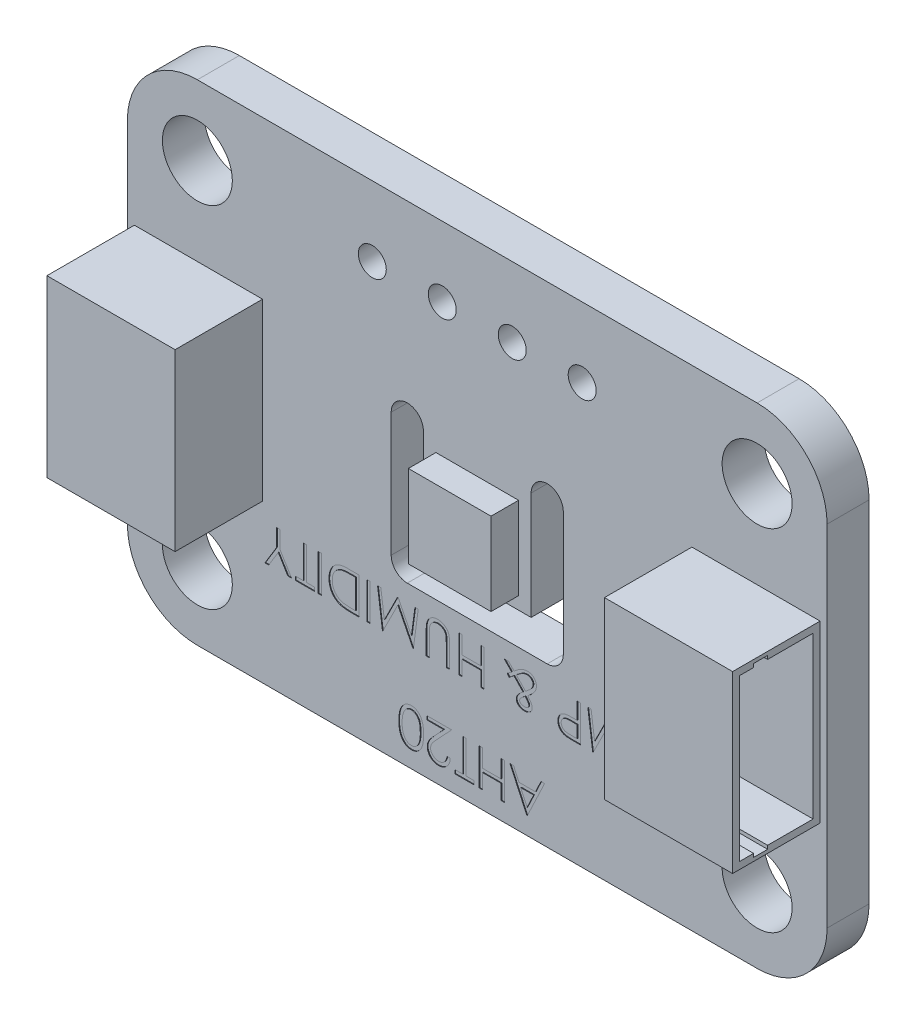
from build123d import *

# Parameters (mm, degrees)
SKETCH1_W           = 25.4
SKETCH1_H           = 17.78
BOSS_EXTRUDE1_DEPTH = 0.762
SKETCH2_R           = 1.27
SKETCH2_R_2         = 0.508
CUT_EXTRUDE1_DEPTH  = 16.577056076
SKETCH6_W           = 4.652
SKETCH6_H           = 6.35
BOSS_EXTRUDE4_DEPTH = 3.175
CUT_EXTRUDE2_DEPTH  = 3.175
CUT_EXTRUDE3_DEPTH  = 16.824118459
FILLET1_R           = 2.54
SKETCH9_W           = 3
SKETCH9_H           = 3
BOSS_EXTRUDE5_DEPTH = 1
SKETCH10_W          = 0.118723291
SKETCH10_H          = 1.322916667
SKETCH10_W_2        = 0.11872329
CUT_EXTRUDE4_DEPTH  = 0.0254


with BuildPart() as part:
    # Sketch1 → Boss-Extrude1 (new, symmetric)
    with BuildSketch(Plane.XY):
        Rectangle(SKETCH1_W, SKETCH1_H)
    extrude(amount=BOSS_EXTRUDE1_DEPTH, both=True)

    # Sketch2 → Cut-Extrude1 (cut, through all)
    with BuildSketch(Plane.XY.offset(0.762)):
        with Locations((-10.16, 6.35)):
            Circle(SKETCH2_R)
        with Locations((10.16, 6.35)):
            Circle(SKETCH2_R)
        with Locations((-10.16, -6.35)):
            Circle(SKETCH2_R)
        with Locations((10.16, -6.35)):
            Circle(SKETCH2_R)
        with Locations((-3.81, 6.35)):
            Circle(SKETCH2_R_2)
        with Locations((-1.27, 6.35)):
            Circle(SKETCH2_R_2)
        with Locations((1.27, 6.35)):
            Circle(SKETCH2_R_2)
        with Locations((3.81, 6.35)):
            Circle(SKETCH2_R_2)
    extrude(amount=-CUT_EXTRUDE1_DEPTH, mode=Mode.SUBTRACT)

    # Sketch6 → Boss-Extrude4 (add)
    with BuildSketch(Plane.XY.offset(0.762)):
        with Locations((-10.12, 0)):
            Rectangle(SKETCH6_W, SKETCH6_H)
        with Locations((10.12, 0)):
            Rectangle(SKETCH6_W, SKETCH6_H)
    extrude(amount=BOSS_EXTRUDE4_DEPTH)

    # Sketch7 → Cut-Extrude2 (cut)
    with BuildSketch(Plane.ZY.offset(12.446)):
        Polygon((1.016, -2.921), (2.667, -2.921), (2.667, -3.048), (3.175, -3.048), (3.175, -2.921), (3.683, -2.921), (3.683, 2.921), (3.175, 2.921), (3.175, 3.048), (2.667, 3.048), (2.667, 2.921), (1.016, 2.921), align=None)
    cut_extrude2 = extrude(amount=-CUT_EXTRUDE2_DEPTH, mode=Mode.SUBTRACT)

    # Mirror1: Cut-Extrude2 across plane
    add(cut_extrude2.mirror(Plane(origin=(0, 0, 0), x_dir=(0, 0, 1), z_dir=(1, 0, 0))), mode=Mode.SUBTRACT)

    # Sketch8 → Cut-Extrude3 (cut, through all)
    with BuildSketch(Plane.XY.offset(0.762)):
        with BuildLine():
            Line((-3.1242, 1.9558), (-3.1242, -2.54))
            ThreePointArc((-3.1242, -2.54), (-2.953091782, -2.953091782), (-2.54, -3.1242))
            Line((-2.54, -3.1242), (2.54, -3.1242))
            ThreePointArc((2.54, -3.1242), (2.953091782, -2.953091782), (3.1242, -2.54))
            Line((3.1242, -2.54), (3.1242, 1.9558))
            ThreePointArc((3.1242, 1.9558), (2.54, 2.54), (1.9558, 1.9558))
            Line((1.9558, 1.9558), (1.9558, -1.9558))
            Line((1.9558, -1.9558), (-1.9558, -1.9558))
            Line((-1.9558, -1.9558), (-1.9558, 1.9558))
            ThreePointArc((-1.9558, 1.9558), (-2.54, 2.54), (-3.1242, 1.9558))
        make_face()
    extrude(amount=-CUT_EXTRUDE3_DEPTH, mode=Mode.SUBTRACT)

    # Fillet1
    fillet1_edges = [part.edges().sort_by_distance(p)[0] for p in [
        (12.7, -8.89, 0),
        (-12.7, -8.89, 0),
        (-12.7, 8.89, 0),
        (12.7, 8.89, 0),
    ]]
    fillet(fillet1_edges, radius=FILLET1_R)

    # Sketch9 → Boss-Extrude5 (add)
    with BuildSketch(Plane.XY.offset(0.762)):
        Rectangle(SKETCH9_W, SKETCH9_H)
    extrude(amount=BOSS_EXTRUDE5_DEPTH)

    # Sketch10 → Cut-Extrude4 (cut)
    # profile 1 of 18: a face of its own
    with BuildSketch(Plane.XY.offset(0.762)):
        Polygon((1.800733542, -8.257116667), (1.190156619, -6.9342), (1.319215196, -6.9342), (1.514790616, -7.358211752), (2.114502238, -7.358211752), (2.315377806, -6.9342), (2.445231405, -6.9342), (1.817694012, -8.257116667), align=None)
        Polygon((1.810538813, -7.998999513), (2.049840446, -7.493895513), (1.57733235, -7.493895513), align=None, mode=Mode.SUBTRACT)
    # profile 2 of 18: a face of its own
    with BuildSketch(Plane.XY.offset(0.762)):
        Polygon((0.986630978, -8.257116667), (0.867907687, -8.257116667), (0.867907687, -7.714381624), (0.189488884, -7.714381624), (0.189488884, -8.257116667), (0.070765593, -8.257116667), (0.070765593, -6.9342), (0.189488884, -6.9342), (0.189488884, -7.578697863), (0.867907687, -7.578697863), (0.867907687, -6.9342), (0.986630978, -6.9342), align=None)
    # profile 3 of 18: a face of its own
    with BuildSketch(Plane.XY.offset(0.762)):
        Polygon((-0.115799578, -8.121432906), (-0.115799578, -8.257116667), (-0.811178851, -8.257116667), (-0.811178851, -8.121432906), (-0.52285086, -8.121432906), (-0.52285086, -6.9342), (-0.404127569, -6.9342), (-0.404127569, -8.121432906), align=None)
    # profile 4 of 18: a face of its own
    with BuildSketch(Plane.XY.offset(0.762)):
        with BuildLine():
            Line((-1.099506843, -7.850065385), (-0.980783552, -7.850065385))
            add(Edge.make_bspline(
                [(-0.980783552, -7.850065385), (-0.981557196, -7.865816066), (-0.983076611, -7.896749984), (-0.990195119, -7.941850481), (-1.000371385, -7.984964455), (-1.014793526, -8.025722284), (-1.032603611, -8.064610854), (-1.054408309, -8.101113769), (-1.079742779, -8.135593317), (-1.108560545, -8.167396686), (-1.139830476, -8.196468941), (-1.173365218, -8.221839993), (-1.208820096, -8.243030794), (-1.245887591, -8.260842151), (-1.284996399, -8.274195504), (-1.325772683, -8.284107825), (-1.368400748, -8.29007059), (-1.397444414, -8.2907116), (-1.41221551, -8.291037607)],
                knots=[0, 0, 0, 0, 1.100776268, 2.161895295, 3.184016182, 4.190939212, 5.176500551, 6.166955529, 7.155448256, 8.160289653, 9.16017456, 10.133824356, 11.091467644, 12.04088621, 13.000931625, 13.972173743, 14.968683325, 16, 16, 16, 16], degree=3))
            add(Edge.make_bspline(
                [(-1.41221551, -8.291037607), (-1.426722529, -8.290700768), (-1.455228303, -8.29003889), (-1.496814683, -8.284269397), (-1.536498063, -8.275428162), (-1.573828711, -8.262326844), (-1.609189746, -8.245887557), (-1.642143339, -8.225443149), (-1.673486342, -8.201960982), (-1.701680495, -8.174262614), (-1.727580225, -8.144708386), (-1.749904227, -8.113144718), (-1.769129834, -8.080506914), (-1.784865392, -8.046540025), (-1.796793645, -8.011133437), (-1.805631337, -7.974626607), (-1.810683439, -7.93659822), (-1.811454549, -7.910854823), (-1.811846587, -7.897766707)],
                knots=[0, 0, 0, 0, 1.111674182, 2.184400057, 3.212814286, 4.223731311, 5.211378316, 6.196328225, 7.191884489, 8.207283132, 9.220262353, 10.201199469, 11.166417575, 12.120932471, 13.06540007, 14.026332106, 14.996573967, 16, 16, 16, 16], degree=3))
            add(Edge.make_bspline(
                [(-1.811846587, -7.897766707), (-1.811205478, -7.879341617), (-1.809934512, -7.84281477), (-1.799097214, -7.789130222), (-1.782097148, -7.737183696), (-1.761874123, -7.695214035), (-1.741550069, -7.661359221), (-1.722754866, -7.63374513), (-1.701047623, -7.603849707), (-1.676108655, -7.57170511), (-1.647561261, -7.537721692), (-1.616494431, -7.500986443), (-1.581537387, -7.46266043), (-1.557111209, -7.436453381), (-1.544454175, -7.422873544)],
                knots=[0, 0, 0, 0, 1.184219417, 2.34765746, 3.508456027, 4.692825395, 5.335023057, 6.047372803, 6.840716919, 7.711366838, 8.663720231, 9.695456184, 10.805843131, 12, 12, 12, 12], degree=3))
            Line((-1.544454175, -7.422873544), (-1.213460001, -7.069883761))
            Line((-1.213460001, -7.069883761), (-1.828807057, -7.069883761))
            Line((-1.828807057, -7.069883761), (-1.828807057, -6.9342))
            Line((-1.828807057, -6.9342), (-0.929902142, -6.9342))
            Line((-0.929902142, -6.9342), (-1.442956362, -7.481705175))
            add(Edge.make_bspline(
                [(-1.442956362, -7.481705175), (-1.455448561, -7.494744002), (-1.479443518, -7.519788921), (-1.513367559, -7.556364813), (-1.543885814, -7.590256931), (-1.571018527, -7.621615459), (-1.594788022, -7.650262623), (-1.615118248, -7.676422924), (-1.632099061, -7.699871862), (-1.650095184, -7.727418694), (-1.667255682, -7.761091659), (-1.682338003, -7.802034794), (-1.691468636, -7.844275747), (-1.692569534, -7.872812288), (-1.693123296, -7.887166413)],
                knots=[0, 0, 0, 0, 1.329530082, 2.553755191, 3.672934919, 4.687409497, 5.60679272, 6.413407421, 7.126401618, 7.737995624, 8.834647426, 9.90044882, 10.943907757, 12, 12, 12, 12], degree=3))
            add(Edge.make_bspline(
                [(-1.693123296, -7.887166413), (-1.692885469, -7.89619401), (-1.692416757, -7.913985671), (-1.688201795, -7.940053893), (-1.682009179, -7.965297234), (-1.672464445, -7.989403577), (-1.660996798, -8.012847048), (-1.646346034, -8.034914893), (-1.629604057, -8.05635935), (-1.610184186, -8.076445109), (-1.588864776, -8.094846782), (-1.566338837, -8.11114631), (-1.542507589, -8.124768327), (-1.517470349, -8.135935042), (-1.491297224, -8.14469479), (-1.46393751, -8.150764549), (-1.435466827, -8.154575489), (-1.41602619, -8.155091113), (-1.406120341, -8.155353846)],
                knots=[0, 0, 0, 0, 0.991504627, 1.954065223, 2.895985987, 3.842598665, 4.797835564, 5.759220273, 6.74786863, 7.784730864, 8.824135544, 9.839918996, 10.835834653, 11.835434876, 12.84861661, 13.863796685, 14.911511676, 16, 16, 16, 16], degree=3))
            add(Edge.make_bspline(
                [(-1.406120341, -8.155353846), (-1.395772175, -8.155094327), (-1.375450087, -8.154584675), (-1.345676878, -8.150721932), (-1.317075412, -8.144872004), (-1.290086429, -8.135558967), (-1.264145098, -8.124659273), (-1.239913196, -8.110546088), (-1.216710018, -8.094419591), (-1.195002071, -8.075617119), (-1.175230822, -8.054391961), (-1.157244739, -8.031288752), (-1.142004953, -8.005897918), (-1.128476749, -7.97882872), (-1.118130344, -7.949337455), (-1.109284909, -7.918145369), (-1.102859713, -7.884807422), (-1.100643029, -7.861838407), (-1.099506843, -7.850065385)],
                knots=[0, 0, 0, 0, 1.031072318, 2.024855787, 2.988461151, 3.935103592, 4.865765533, 5.788564469, 6.724086513, 7.67908574, 8.64457978, 9.611397706, 10.591395687, 11.591555111, 12.622101007, 13.700900657, 14.821571223, 16, 16, 16, 16], degree=3))
        make_face()
    # profile 5 of 18: a face of its own
    with BuildSketch(Plane.XY.offset(0.762)):
        with BuildLine():
            add(Edge.make_bspline(
                [(-1.947530347, -7.595128319), (-1.94765433, -7.616331796), (-1.947895169, -7.657519855), (-1.950574424, -7.717536669), (-1.955025222, -7.773840112), (-1.961124766, -7.826432877), (-1.968547451, -7.875328548), (-1.978456295, -7.920396434), (-1.989724778, -7.961845198), (-2.002784935, -7.999809754), (-2.017520857, -8.034802428), (-2.033561881, -8.067467311), (-2.051533561, -8.097765383), (-2.070447522, -8.126143049), (-2.090965718, -8.152314726), (-2.113016796, -8.176162792), (-2.136406528, -8.198056809), (-2.161245588, -8.217636758), (-2.187297229, -8.234698071), (-2.21379081, -8.250163766), (-2.241481981, -8.262397557), (-2.269687724, -8.272858858), (-2.298635288, -8.281145622), (-2.328337282, -8.286909717), (-2.35882036, -8.290515857), (-2.379393796, -8.29086204), (-2.389827606, -8.291037607)],
                knots=[0, 0, 0, 0, 1.64625301, 3.197870201, 4.6634513, 6.030635694, 7.308242971, 8.501545196, 9.611429483, 10.641742253, 11.616230371, 12.55791849, 13.464870342, 14.34944951, 15.20427819, 16.044004467, 16.869007726, 17.689551165, 18.496129964, 19.285613293, 20.0683943, 20.843080271, 21.620342827, 22.403213977, 23.190190624, 24, 24, 24, 24], degree=3))
            add(Edge.make_bspline(
                [(-2.389827606, -8.291037607), (-2.400353857, -8.290891614), (-2.42129739, -8.290601138), (-2.452149753, -8.286512525), (-2.48246472, -8.281235233), (-2.511782354, -8.272771327), (-2.540656994, -8.262643165), (-2.568370586, -8.249279216), (-2.595901568, -8.234744884), (-2.621999242, -8.217014221), (-2.64744336, -8.197418921), (-2.671294564, -8.175173246), (-2.694162555, -8.150892848), (-2.715183617, -8.124036202), (-2.735258684, -8.0950151), (-2.753625687, -8.063586263), (-2.770666625, -8.02981934), (-2.786701822, -7.993870871), (-2.800724179, -7.954780615), (-2.813191175, -7.91279239), (-2.823409988, -7.867525971), (-2.831860767, -7.819233521), (-2.83842018, -7.7676758), (-2.843194009, -7.712957271), (-2.845716563, -7.655043699), (-2.846191526, -7.615447714), (-2.846435262, -7.595128319)],
                knots=[0, 0, 0, 0, 0.810910589, 1.61342667, 2.396193133, 3.181089899, 3.963115317, 4.752255436, 5.550715454, 6.36105385, 7.181178335, 8.024612154, 8.872680183, 9.750181803, 10.651284446, 11.591556747, 12.554036451, 13.566402641, 14.62422919, 15.753422176, 16.94128843, 18.199818041, 19.531985927, 20.947085226, 22.433341622, 24, 24, 24, 24], degree=3))
            add(Edge.make_bspline(
                [(-2.846435262, -7.595128319), (-2.84618586, -7.574897808), (-2.845698824, -7.535391248), (-2.843251419, -7.4777345), (-2.838292209, -7.423314555), (-2.832247828, -7.372052569), (-2.823533014, -7.32401555), (-2.813830822, -7.27894552), (-2.801455131, -7.237265968), (-2.787765382, -7.198510785), (-2.771953303, -7.162714596), (-2.755040704, -7.129087052), (-2.736399523, -7.097836581), (-2.71670966, -7.068631529), (-2.695290627, -7.042005212), (-2.672732108, -7.017453208), (-2.648649511, -6.995168884), (-2.623074413, -6.975342216), (-2.596730069, -6.95747799), (-2.56919372, -6.942425408), (-2.541109968, -6.929302628), (-2.512186705, -6.918753447), (-2.482608366, -6.910414278), (-2.452268436, -6.904737432), (-2.421293264, -6.900735971), (-2.400352477, -6.900431891), (-2.389827606, -6.90027906)],
                knots=[0, 0, 0, 0, 1.561431216, 3.049195289, 4.452146966, 5.778046447, 7.031138842, 8.218704273, 9.334037798, 10.384210803, 11.388620812, 12.352076869, 13.287433199, 14.19507451, 15.06813243, 15.922055533, 16.766344942, 17.596869952, 18.417486629, 19.220035357, 20.016159057, 20.807716045, 21.59340902, 22.384936649, 23.188266813, 24, 24, 24, 24], degree=3))
            add(Edge.make_bspline(
                [(-2.389827606, -6.90027906), (-2.37939416, -6.900456183), (-2.35882144, -6.900805434), (-2.32833311, -6.9043891), (-2.298674182, -6.910232851), (-2.269785365, -6.918168635), (-2.241607544, -6.928254551), (-2.214416721, -6.941083446), (-2.187853902, -6.955963026), (-2.162039904, -6.972891117), (-2.137468213, -6.992291092), (-2.113992354, -7.013743777), (-2.09222679, -7.037802031), (-2.071850095, -7.064081867), (-2.0527792, -7.092530969), (-2.034883624, -7.12306099), (-2.018891451, -7.156044085), (-2.003821409, -7.191226719), (-1.990537053, -7.229470228), (-1.978937398, -7.271061031), (-1.969157833, -7.316282815), (-1.961368273, -7.365137745), (-1.954986887, -7.417550191), (-1.950578811, -7.473603674), (-1.947896509, -7.533178132), (-1.947654628, -7.574101428), (-1.947530347, -7.595128319)],
                knots=[0, 0, 0, 0, 0.810976328, 1.599087026, 2.383086309, 3.159618043, 3.926613167, 4.707144544, 5.494386734, 6.292609454, 7.104690378, 7.92621526, 8.762510248, 9.62398222, 10.509836085, 11.424023232, 12.373226806, 13.358118208, 14.398657954, 15.5185989, 16.713620699, 17.994156382, 19.364120462, 20.818119981, 22.365111093, 24, 24, 24, 24], degree=3))
        make_face()
        with BuildLine():
            add(Edge.make_bspline(
                [(-2.066253638, -7.595658333), (-2.066299776, -7.577988509), (-2.066389321, -7.543694849), (-2.068660923, -7.493948336), (-2.071822761, -7.447471803), (-2.075800537, -7.404283394), (-2.081757816, -7.364534044), (-2.088516729, -7.328058518), (-2.096623581, -7.294924275), (-2.106262911, -7.264841953), (-2.117242467, -7.23738492), (-2.129211156, -7.211823616), (-2.142175833, -7.187847126), (-2.156433947, -7.165541957), (-2.172189774, -7.145032689), (-2.189091641, -7.126221916), (-2.207237825, -7.109186231), (-2.232352108, -7.088968325), (-2.265346353, -7.067829776), (-2.307130265, -7.049648615), (-2.350084043, -7.038149063), (-2.37924672, -7.036690723), (-2.393802716, -7.035962821)],
                knots=[0, 0, 0, 0, 1.459193451, 2.832007961, 4.111736495, 5.306635028, 6.412683014, 7.430020708, 8.369596877, 9.227877302, 10.036669781, 10.810175692, 11.557788084, 12.286326232, 12.994037279, 13.69140682, 14.37267704, 15.047194847, 16.352618509, 17.594157723, 18.799169539, 20, 20, 20, 20], degree=3))
            add(Edge.make_bspline(
                [(-2.393802716, -7.035962821), (-2.408442295, -7.036601091), (-2.437669524, -7.037875369), (-2.480594065, -7.048996764), (-2.521920654, -7.067076621), (-2.554535159, -7.087732429), (-2.579278841, -7.107529572), (-2.597013822, -7.124389079), (-2.613289841, -7.143272254), (-2.628727287, -7.163644614), (-2.642885894, -7.185897092), (-2.655760958, -7.209922209), (-2.667509721, -7.235786816), (-2.674203319, -7.253842639), (-2.677625583, -7.263074115)],
                knots=[0, 0, 0, 0, 1.353621445, 2.702441307, 4.075953605, 5.516772412, 6.261413105, 7.007624062, 7.778524365, 8.566925914, 9.372323995, 10.217594641, 11.088702136, 12, 12, 12, 12], degree=3))
            add(Edge.make_bspline(
                [(-2.677625583, -7.263074115), (-2.6816139, -7.274878213), (-2.689711894, -7.298845594), (-2.700148487, -7.336024713), (-2.70836773, -7.3750329), (-2.715762217, -7.415637037), (-2.720809354, -7.458136567), (-2.724871771, -7.502399991), (-2.72726462, -7.548460685), (-2.727561238, -7.57975522), (-2.727711971, -7.595658333)],
                knots=[0, 0, 0, 0, 0.884706709, 1.796334032, 2.740027952, 3.714592787, 4.726048262, 5.777819803, 6.87074269, 8, 8, 8, 8], degree=3))
            add(Edge.make_bspline(
                [(-2.727711971, -7.595658333), (-2.727545728, -7.611561105), (-2.727220481, -7.642674173), (-2.725083578, -7.68819262), (-2.721649753, -7.731500883), (-2.717002146, -7.77263825), (-2.710621965, -7.811531502), (-2.702959999, -7.848236291), (-2.693977236, -7.882742738), (-2.683673692, -7.91513977), (-2.672061906, -7.945311159), (-2.659233794, -7.973321853), (-2.645546434, -7.999322927), (-2.630670191, -8.023230749), (-2.614815537, -8.045184824), (-2.597413188, -8.064679782), (-2.579568528, -8.082663999), (-2.554189644, -8.102825631), (-2.521234395, -8.123545037), (-2.479944065, -8.14209361), (-2.437210354, -8.153071155), (-2.408261496, -8.154593498), (-2.393802716, -8.155353846)],
                knots=[0, 0, 0, 0, 1.313528337, 2.569860077, 3.762944266, 4.901481389, 5.988248151, 7.017139294, 7.997571128, 8.932104357, 9.823695246, 10.66607014, 11.475539426, 12.248954257, 12.990316782, 13.708962568, 14.405488541, 15.08007697, 16.381737273, 17.610043218, 18.806313575, 20, 20, 20, 20], degree=3))
            add(Edge.make_bspline(
                [(-2.393802716, -8.155353846), (-2.379168196, -8.154592598), (-2.349872496, -8.153068715), (-2.306691741, -8.14213234), (-2.265154228, -8.123676961), (-2.232268427, -8.10280001), (-2.207246827, -8.082742298), (-2.189441009, -8.065623465), (-2.172636963, -8.046988613), (-2.156956615, -8.026572334), (-2.142785494, -8.004309697), (-2.129663243, -7.980507023), (-2.117790044, -7.95498369), (-2.106769045, -7.927541832), (-2.097231993, -7.897410079), (-2.088657071, -7.864282443), (-2.082038522, -7.827569702), (-2.076161833, -7.787633689), (-2.071719723, -7.744393931), (-2.068682959, -7.697807378), (-2.066382421, -7.647887451), (-2.066297425, -7.613416732), (-2.066253638, -7.595658333)],
                knots=[0, 0, 0, 0, 1.207779899, 2.417760083, 3.652287919, 4.947299644, 5.621638849, 6.297435916, 6.984320042, 7.691843698, 8.42018894, 9.161205785, 9.934506883, 10.743085206, 11.601138371, 12.542248028, 13.566483018, 14.679455109, 15.87477181, 17.154161492, 18.533899613, 20, 20, 20, 20], degree=3))
        make_face(mode=Mode.SUBTRACT)
    # profile 6 of 18: a face of its own
    with BuildSketch(Plane.XY.offset(0.762)):
        Polygon((7.338327025, -4.933532265), (7.338327025, -5.069216026), (6.642947751, -5.069216026), (6.642947751, -4.933532265), (6.931275743, -4.933532265), (6.931275743, -3.746299359), (7.049999033, -3.746299359), (7.049999033, -4.933532265), align=None)
    # profile 7 of 18: a face of its own
    with BuildSketch(Plane.XY.offset(0.762)):
        Polygon((6.40550117, -5.069216026), (5.659240486, -5.069216026), (5.659240486, -4.933532265), (6.286777879, -4.933532265), (6.286777879, -4.526480983), (5.659240486, -4.526480983), (5.659240486, -4.390797222), (6.286777879, -4.390797222), (6.286777879, -3.88198312), (5.659240486, -3.88198312), (5.659240486, -3.746299359), (6.40550117, -3.746299359), align=None)
    # profile 8 of 18: a face of its own
    with BuildSketch(Plane.XY.offset(0.762)):
        Polygon((5.489635785, -3.746299359), (5.314995945, -5.069216026), (5.298035475, -5.069216026), (4.751855337, -3.98374594), (4.207265242, -5.069216026), (4.190304772, -5.069216026), (4.014074888, -3.746299359), (4.132798178, -3.746299359), (4.260001704, -4.69741072), (4.737279933, -3.746299359), (4.764310682, -3.746299359), (5.243708969, -4.700325801), (5.370117473, -3.746299359), align=None)
    # profile 9 of 18: a face of its own
    with BuildSketch(Plane.XY.offset(0.762)):
        with BuildLine():
            Line((3.742707366, -5.069216026), (3.483265176, -5.069216026))
            add(Edge.make_bspline(
                [(3.483265176, -5.069216026), (3.465420577, -5.06919641), (3.431229534, -5.069158826), (3.382200331, -5.068019324), (3.337671058, -5.06649733), (3.297737729, -5.064387507), (3.262277478, -5.061894153), (3.231450761, -5.058397103), (3.205015274, -5.054745741), (3.189175633, -5.051033483), (3.181951824, -5.049340475)],
                knots=[0, 0, 0, 0, 1.415646017, 2.712440637, 3.8905458, 4.950247383, 5.884950622, 6.709939814, 7.411656543, 8, 8, 8, 8], degree=3))
            add(Edge.make_bspline(
                [(3.181951824, -5.049340475), (3.172807303, -5.04683746), (3.154733739, -5.041890411), (3.128689944, -5.03198334), (3.103915272, -5.020230965), (3.080306092, -5.006856555), (3.058266856, -4.991228507), (3.037109457, -4.97424882), (3.017277596, -4.955230793), (2.999070727, -4.934199466), (2.982201278, -4.911843817), (2.968080339, -4.88759379), (2.955610995, -4.862290626), (2.945893521, -4.835316542), (2.938255213, -4.807027593), (2.932692226, -4.77735015), (2.929116775, -4.746348236), (2.928777509, -4.725158212), (2.928604802, -4.714371191)],
                knots=[0, 0, 0, 0, 0.999333726, 1.975119402, 2.933498163, 3.889020618, 4.832249799, 5.779334906, 6.747801194, 7.724875447, 8.710438469, 9.696133548, 10.679360639, 11.681339199, 12.714023775, 13.766351759, 14.862936069, 16, 16, 16, 16], degree=3))
            add(Edge.make_bspline(
                [(2.928604802, -4.714371191), (2.928764091, -4.703493876), (2.92907575, -4.682211676), (2.93281631, -4.651076723), (2.937854805, -4.621323046), (2.945602203, -4.593016617), (2.955749228, -4.566325537), (2.967652474, -4.540841916), (2.982009344, -4.516999302), (2.998506051, -4.494711136), (3.016857397, -4.473956496), (3.03698574, -4.454885785), (3.058809818, -4.437610634), (3.082260273, -4.422092313), (3.107565721, -4.408690684), (3.134342369, -4.396687179), (3.162822957, -4.386606153), (3.182531585, -4.381303124), (3.192552118, -4.378606884)],
                knots=[0, 0, 0, 0, 1.121902311, 2.195077645, 3.232258892, 4.234102512, 5.217864754, 6.176164875, 7.132989551, 8.084763148, 9.034132444, 9.988522005, 10.94243251, 11.903244335, 12.886203696, 13.894208494, 14.929344452, 16, 16, 16, 16], degree=3))
            add(Edge.make_bspline(
                [(3.192552118, -4.378606884), (3.200840223, -4.376845702), (3.219004086, -4.372985969), (3.248916275, -4.368647736), (3.283760623, -4.365089912), (3.323418575, -4.361769722), (3.367982611, -4.360010436), (3.417350524, -4.357944748), (3.471689391, -4.356970062), (3.509589057, -4.35690845), (3.529376454, -4.356876282)],
                knots=[0, 0, 0, 0, 0.601372724, 1.317943291, 2.144091499, 3.08771165, 4.142394186, 5.309582461, 6.595334295, 8, 8, 8, 8], degree=3))
            Line((3.529376454, -4.356876282), (3.623984076, -4.356876282))
            Line((3.623984076, -4.356876282), (3.623984076, -3.746299359))
            Line((3.623984076, -3.746299359), (3.742707366, -3.746299359))
            Line((3.742707366, -3.746299359), (3.742707366, -5.069216026))
        make_face()
        with BuildLine():
            Line((3.623984076, -4.933532265), (3.623984076, -4.492560043))
            Line((3.623984076, -4.492560043), (3.392367656, -4.489644962))
            add(Edge.make_bspline(
                [(3.392367656, -4.489644962), (3.381058446, -4.489637505), (3.35922625, -4.489623109), (3.327603817, -4.491155259), (3.298336126, -4.492822065), (3.271379965, -4.495517686), (3.246858368, -4.498805503), (3.224711965, -4.503201331), (3.204764018, -4.507684791), (3.181786192, -4.515464391), (3.156048617, -4.527200905), (3.128114234, -4.544730851), (3.104246594, -4.566814176), (3.083767013, -4.591912104), (3.067579303, -4.619861902), (3.055847367, -4.649683529), (3.048686437, -4.681263747), (3.047786369, -4.702850249), (3.047328093, -4.713841176)],
                knots=[0, 0, 0, 0, 1.160501667, 2.240324542, 3.248665471, 4.168823117, 5.020172044, 5.786515869, 6.485785279, 7.116517804, 8.272762037, 9.381837012, 10.485674779, 11.594342068, 12.695271952, 13.786226926, 14.872841088, 16, 16, 16, 16], degree=3))
            add(Edge.make_bspline(
                [(3.047328093, -4.713841176), (3.047806815, -4.724476027), (3.048758455, -4.745616795), (3.055788215, -4.776615162), (3.067703547, -4.806097764), (3.08378021, -4.833826033), (3.103769029, -4.858857254), (3.12716199, -4.880448423), (3.153595137, -4.897923945), (3.177991833, -4.909557234), (3.199824955, -4.916379254), (3.218697703, -4.921304406), (3.240115384, -4.92470118), (3.263875309, -4.927951253), (3.289947055, -4.930574769), (3.318496408, -4.932396622), (3.349428271, -4.933451673), (3.370901214, -4.933504751), (3.38203237, -4.933532265)],
                knots=[0, 0, 0, 0, 1.12039168, 2.227199994, 3.330242575, 4.460839274, 5.593542475, 6.693949254, 7.801736126, 8.92216649, 9.528704869, 10.210659466, 10.975987387, 11.81211542, 12.738540127, 13.736887663, 14.826846554, 16, 16, 16, 16], degree=3))
            Line((3.38203237, -4.933532265), (3.623984076, -4.933532265))
        make_face(mode=Mode.SUBTRACT)
    # profile 10 of 18: a face of its own
    with BuildSketch(Plane.XY.offset(0.762)):
        with BuildLine():
            Line((1.162330847, -4.238152991), (1.087068761, -4.150965575))
            add(Edge.make_bspline(
                [(1.087068761, -4.150965575), (1.101282988, -4.139383958), (1.129080287, -4.116734983), (1.170101295, -4.083581692), (1.209141889, -4.051470763), (1.23483948, -4.03072209), (1.247398205, -4.020581961)],
                knots=[0, 0, 0, 0, 1.064691343, 2.082107176, 3.062702409, 4, 4, 4, 4], degree=3))
            add(Edge.make_bspline(
                [(1.247398205, -4.020581961), (1.236456914, -4.00935121), (1.213659452, -3.985950624), (1.177795722, -3.949642248), (1.139122272, -3.910490811), (1.112499587, -3.883317881), (1.098729085, -3.869262767)],
                knots=[0, 0, 0, 0, 0.886952813, 1.848070168, 2.88692091, 4, 4, 4, 4], degree=3))
            add(Edge.make_bspline(
                [(1.098729085, -3.869262767), (1.087752129, -3.858155328), (1.066368519, -3.83651753), (1.035580708, -3.804592541), (1.005964147, -3.775105685), (0.987219681, -3.755692053), (0.978150743, -3.746299359)],
                knots=[0, 0, 0, 0, 1.088114003, 2.119695705, 3.090272096, 4, 4, 4, 4], degree=3))
            Line((0.978150743, -3.746299359), (1.137685164, -3.746299359))
            Line((1.137685164, -3.746299359), (1.336175666, -3.948499963))
            add(Edge.make_bspline(
                [(1.336175666, -3.948499963), (1.350348425, -3.937042296), (1.37769847, -3.914931732), (1.418073997, -3.88394339), (1.455937601, -3.855794756), (1.491449256, -3.830600849), (1.524482236, -3.808258841), (1.55531997, -3.789046676), (1.583838533, -3.772961486), (1.618369553, -3.755082246), (1.661231358, -3.738063926), (1.713554028, -3.723031703), (1.767474978, -3.714048622), (1.803880743, -3.712937503), (1.822199137, -3.712378419)],
                knots=[0, 0, 0, 0, 1.187781165, 2.292134433, 3.316965486, 4.262667778, 5.129742489, 5.915789236, 6.629914127, 7.263331365, 8.448989695, 9.628130096, 10.806539369, 12, 12, 12, 12], degree=3))
            add(Edge.make_bspline(
                [(1.822199137, -3.712378419), (1.834227972, -3.712588423), (1.857658465, -3.712997483), (1.8918605, -3.717476938), (1.924305233, -3.724166459), (1.954895419, -3.734078867), (1.983803135, -3.746569119), (2.01082943, -3.76192397), (2.036034913, -3.780178723), (2.059097037, -3.800988592), (2.080070949, -3.823764936), (2.098438431, -3.848139543), (2.113815849, -3.874064023), (2.126784182, -3.901096957), (2.136112812, -3.929786069), (2.143461398, -3.959588886), (2.147736609, -3.990953686), (2.148191802, -4.012354123), (2.148423178, -4.023232035)],
                knots=[0, 0, 0, 0, 1.141328432, 2.223148619, 3.269272742, 4.282403712, 5.270191411, 6.254233896, 7.227207257, 8.218974262, 9.198324066, 10.16276639, 11.110584224, 12.055987328, 13.002765725, 13.96895668, 14.967614106, 16, 16, 16, 16], degree=3))
            add(Edge.make_bspline(
                [(2.148423178, -4.023232035), (2.147750122, -4.040086613), (2.146391507, -4.074108862), (2.133784846, -4.124784208), (2.114639785, -4.175511243), (2.092108031, -4.217458384), (2.068966507, -4.25149893), (2.047839355, -4.279431995), (2.022061947, -4.308471276), (1.992619481, -4.339483255), (1.959230155, -4.372298653), (1.921790866, -4.406702142), (1.880442204, -4.442765419), (1.851148775, -4.466841935), (1.835979519, -4.479309675)],
                knots=[0, 0, 0, 0, 1.059088185, 2.137850084, 3.267369303, 4.466172507, 5.122991116, 5.856810422, 6.668435759, 7.564982458, 8.54772928, 9.613869939, 10.764370718, 12, 12, 12, 12], degree=3))
            add(Edge.make_bspline(
                [(1.835979519, -4.479309675), (1.844138779, -4.489619619), (1.859808502, -4.509419691), (1.881827013, -4.538296056), (1.901439698, -4.565130486), (1.919027362, -4.589801519), (1.934335015, -4.612352948), (1.947226238, -4.632961581), (1.957721653, -4.651408302), (1.969112869, -4.67269876), (1.979494604, -4.697998229), (1.989102226, -4.727415855), (1.994575161, -4.75639239), (1.995382174, -4.775479055), (1.995778948, -4.784863144)],
                knots=[0, 0, 0, 0, 1.347760584, 2.588351548, 3.722129367, 4.754775815, 5.694072118, 6.515700693, 7.245751618, 7.869507402, 8.989569735, 10.043476065, 11.038061606, 12, 12, 12, 12], degree=3))
            add(Edge.make_bspline(
                [(1.995778948, -4.784863144), (1.99563256, -4.792742539), (1.995344624, -4.808240898), (1.991366163, -4.830862111), (1.985584046, -4.852563837), (1.977442396, -4.873276538), (1.966540009, -4.892732056), (1.953966567, -4.911506227), (1.938312109, -4.928718966), (1.926700203, -4.939279898), (1.920781869, -4.944662573)],
                knots=[0, 0, 0, 0, 1.03459038, 2.034985263, 3.00970721, 3.984429156, 4.951093115, 5.936753036, 6.948408246, 8, 8, 8, 8], degree=3))
            add(Edge.make_bspline(
                [(1.920781869, -4.944662573), (1.913459241, -4.950533719), (1.8988501, -4.962247055), (1.875185633, -4.977502705), (1.849863958, -4.989785455), (1.823485222, -5.000232163), (1.795842295, -5.008501134), (1.766833289, -5.014273605), (1.736513815, -5.017813624), (1.715852701, -5.018158821), (1.705330897, -5.018334615)],
                knots=[0, 0, 0, 0, 0.967960167, 1.931146414, 2.897088072, 3.866805636, 4.855816412, 5.869216054, 6.914884778, 8, 8, 8, 8], degree=3))
            add(Edge.make_bspline(
                [(1.705330897, -5.018334615), (1.69205757, -5.017919847), (1.665985897, -5.017105151), (1.627721553, -5.01088718), (1.591289408, -5.000502247), (1.556873189, -4.986331439), (1.525519999, -4.968391208), (1.497572381, -4.947563827), (1.473421089, -4.923936125), (1.453859188, -4.897293556), (1.438528485, -4.868940226), (1.427220598, -4.83959204), (1.420277618, -4.809302386), (1.419508449, -4.788785449), (1.419122965, -4.778502968)],
                knots=[0, 0, 0, 0, 1.149766301, 2.258388499, 3.348679816, 4.426160583, 5.475237013, 6.470286963, 7.439114201, 8.39132015, 9.322906339, 10.224157432, 11.110000268, 12, 12, 12, 12], degree=3))
            add(Edge.make_bspline(
                [(1.419122965, -4.778502968), (1.419806271, -4.767230674), (1.421209344, -4.744084592), (1.430837538, -4.709014192), (1.446516566, -4.673295728), (1.464059372, -4.642917874), (1.481958995, -4.617900998), (1.498643019, -4.597334065), (1.518141552, -4.57535896), (1.541188262, -4.552520884), (1.566451179, -4.527761818), (1.595000668, -4.502051346), (1.626509675, -4.475075731), (1.648757486, -4.456914509), (1.660279649, -4.447508794)],
                knots=[0, 0, 0, 0, 0.960594564, 1.972446776, 3.078873293, 4.280028162, 4.954937125, 5.699360946, 6.536703905, 7.457884272, 8.464370467, 9.551903968, 10.732128661, 12, 12, 12, 12], degree=3))
            Line((1.660279649, -4.447508794), (1.460994125, -4.238152991))
            Line((1.460994125, -4.238152991), (1.328490453, -4.102999245))
            add(Edge.make_bspline(
                [(1.328490453, -4.102999245), (1.312506, -4.115989912), (1.281950325, -4.140822706), (1.238222065, -4.176222765), (1.198968703, -4.208465868), (1.174089566, -4.228625073), (1.162330847, -4.238152991)],
                knots=[0, 0, 0, 0, 1.154001856, 2.20597526, 3.152083497, 4, 4, 4, 4], degree=3))
        make_face()
        with BuildLine():
            add(Edge.make_bspline(
                [(1.741636904, -4.545826519), (1.724317308, -4.557504635), (1.691250257, -4.579800817), (1.646777969, -4.615582057), (1.608113067, -4.650159047), (1.586891828, -4.675179588), (1.576802335, -4.687075434)],
                knots=[0, 0, 0, 0, 1.149778042, 2.195187973, 3.141914424, 4, 4, 4, 4], degree=3))
            add(Edge.make_bspline(
                [(1.576802335, -4.687075434), (1.570931306, -4.694886599), (1.55992218, -4.709533791), (1.547641065, -4.732243227), (1.5393775, -4.753650612), (1.538336715, -4.767840855), (1.537846255, -4.774527858)],
                knots=[0, 0, 0, 0, 1.202408741, 2.25471003, 3.177550387, 4, 4, 4, 4], degree=3))
            add(Edge.make_bspline(
                [(1.537846255, -4.774527858), (1.538409035, -4.781683824), (1.539542862, -4.796100879), (1.54899511, -4.816715132), (1.564457865, -4.835127036), (1.585038166, -4.851774581), (1.610458437, -4.865724496), (1.640230608, -4.875725577), (1.673842052, -4.881448448), (1.697446114, -4.88223696), (1.709836022, -4.882650855)],
                knots=[0, 0, 0, 0, 0.764361685, 1.53995218, 2.381101074, 3.3228075, 4.360776426, 5.471305459, 6.672673571, 8, 8, 8, 8], degree=3))
            add(Edge.make_bspline(
                [(1.709836022, -4.882650855), (1.721610489, -4.882248463), (1.744269197, -4.881474103), (1.776577943, -4.875473567), (1.805425342, -4.86508422), (1.830302619, -4.850833256), (1.850790014, -4.83388558), (1.865827221, -4.814793475), (1.875420166, -4.793905003), (1.876510759, -4.779216619), (1.877055657, -4.771877784)],
                knots=[0, 0, 0, 0, 1.276757532, 2.45698398, 3.548279921, 4.587071555, 5.552657936, 6.413258569, 7.207207965, 8, 8, 8, 8], degree=3))
            add(Edge.make_bspline(
                [(1.877055657, -4.771877784), (1.87684396, -4.766211708), (1.876420542, -4.754878866), (1.873244735, -4.738155001), (1.867559997, -4.722098639), (1.862417984, -4.712022148), (1.85983018, -4.706950985)],
                knots=[0, 0, 0, 0, 1.001046439, 2.002214593, 2.994581098, 4, 4, 4, 4], degree=3))
            add(Edge.make_bspline(
                [(1.85983018, -4.706950985), (1.852284494, -4.694318718), (1.83653145, -4.667946476), (1.809043489, -4.628516311), (1.777133307, -4.587433051), (1.753765202, -4.560042507), (1.741636904, -4.545826519)],
                knots=[0, 0, 0, 0, 0.882046208, 1.841438062, 2.879683064, 4, 4, 4, 4], degree=3))
        make_face(mode=Mode.SUBTRACT)
        with BuildLine():
            add(Edge.make_bspline(
                [(1.749322117, -4.379931921), (1.763154208, -4.369397654), (1.789784169, -4.349116764), (1.827310928, -4.318848932), (1.861472233, -4.290579573), (1.891573, -4.263565109), (1.918094845, -4.238394648), (1.941195259, -4.215216462), (1.959943289, -4.193109683), (1.98007428, -4.166984056), (1.999578464, -4.135717448), (2.016562881, -4.098890147), (2.027436266, -4.06333026), (2.028965777, -4.039817476), (2.029699888, -4.028532181)],
                knots=[0, 0, 0, 0, 1.349092588, 2.597314009, 3.740888291, 4.789445907, 5.734913621, 6.578340248, 7.327034661, 7.982360765, 9.136914201, 10.176764902, 11.124912406, 12, 12, 12, 12], degree=3))
            add(Edge.make_bspline(
                [(2.029699888, -4.028532181), (2.029468847, -4.022163441), (2.029007611, -4.009449272), (2.026140732, -3.990652034), (2.020937876, -3.972505047), (2.014147169, -3.954766156), (2.004708266, -3.937986758), (1.993703492, -3.921536656), (1.980771307, -3.905630499), (1.965663007, -3.890763078), (1.949481921, -3.876793343), (1.932140136, -3.864454049), (1.913800341, -3.854178748), (1.894632497, -3.845478694), (1.874346344, -3.839344495), (1.853410582, -3.834365551), (1.831446943, -3.831831899), (1.816550749, -3.831348436), (1.808948769, -3.831101709)],
                knots=[0, 0, 0, 0, 0.931448995, 1.859488378, 2.771478193, 3.687757171, 4.629980898, 5.579349133, 6.579969228, 7.621200637, 8.674777363, 9.703353118, 10.727132485, 11.744864089, 12.774331615, 13.820917255, 14.887947958, 16, 16, 16, 16], degree=3))
            add(Edge.make_bspline(
                [(1.808948769, -3.831101709), (1.797260236, -3.831425112), (1.773912976, -3.832071092), (1.739147975, -3.838381081), (1.704537854, -3.847597621), (1.682354384, -3.857060775), (1.67114495, -3.861842561)],
                knots=[0, 0, 0, 0, 0.985149244, 1.967786319, 2.97311079, 4, 4, 4, 4], degree=3))
            add(Edge.make_bspline(
                [(1.67114495, -3.861842561), (1.661990977, -3.866151481), (1.6430679, -3.875058874), (1.614745838, -3.891060701), (1.584772342, -3.908596617), (1.553833989, -3.928938332), (1.521491822, -3.951197462), (1.487770132, -3.975600555), (1.452858622, -4.002389412), (1.429335134, -4.021244732), (1.417267913, -4.030917248)],
                knots=[0, 0, 0, 0, 0.793866152, 1.641078755, 2.55195156, 3.519315084, 4.546339611, 5.633686856, 6.786114446, 8, 8, 8, 8], degree=3))
            Line((1.417267913, -4.030917248), (1.629538797, -4.247428249))
            add(Edge.make_bspline(
                [(1.629538797, -4.247428249), (1.638745956, -4.257214622), (1.657806717, -4.27747448), (1.687009471, -4.309321371), (1.717668255, -4.343761203), (1.738563027, -4.36763756), (1.749322117, -4.379931921)],
                knots=[0, 0, 0, 0, 0.902624204, 1.868622563, 2.90251587, 4, 4, 4, 4], degree=3))
        make_face(mode=Mode.SUBTRACT)
    # profile 11 of 18: a face of its own
    with BuildSketch(Plane.XY.offset(0.762)):
        Polygon((0.248850529, -5.069216026), (0.130127238, -5.069216026), (0.130127238, -4.526480983), (-0.548291565, -4.526480983), (-0.548291565, -5.069216026), (-0.667014856, -5.069216026), (-0.667014856, -3.746299359), (-0.548291565, -3.746299359), (-0.548291565, -4.390797222), (0.130127238, -4.390797222), (0.130127238, -3.746299359), (0.248850529, -3.746299359), align=None)
    # profile 12 of 18: a face of its own
    with BuildSketch(Plane.XY.offset(0.762)):
        with BuildLine():
            Line((-1.006224257, -5.069216026), (-1.124947548, -5.069216026))
            Line((-1.124947548, -5.069216026), (-1.124947548, -4.276579056))
            add(Edge.make_bspline(
                [(-1.124947548, -4.276579056), (-1.12492988, -4.265360445), (-1.124896352, -4.244071197), (-1.125120308, -4.213769488), (-1.12574751, -4.186830195), (-1.126142933, -4.163149478), (-1.12702261, -4.142835999), (-1.127740026, -4.125779706), (-1.128662498, -4.112061361), (-1.129771147, -4.104055475), (-1.130247695, -4.100614179)],
                knots=[0, 0, 0, 0, 1.528628734, 2.90083645, 4.128790002, 5.200304208, 6.127813768, 6.898992206, 7.526736466, 8, 8, 8, 8], degree=3))
            add(Edge.make_bspline(
                [(-1.130247695, -4.100614179), (-1.132180437, -4.088102594), (-1.135911508, -4.063949542), (-1.145860102, -4.029597793), (-1.159014762, -3.998474102), (-1.175779225, -3.970230724), (-1.196456036, -3.944669079), (-1.221967117, -3.921543408), (-1.252259814, -3.900787089), (-1.286645328, -3.882580108), (-1.323305781, -3.867479614), (-1.360899627, -3.856175011), (-1.398708722, -3.849257842), (-1.424024743, -3.848458912), (-1.436596186, -3.848062179)],
                knots=[0, 0, 0, 0, 1.042923073, 2.013316119, 2.939979093, 3.821796737, 4.712412725, 5.640305549, 6.650442997, 7.732186751, 8.842579391, 9.91407549, 10.964170509, 12, 12, 12, 12], degree=3))
            add(Edge.make_bspline(
                [(-1.436596186, -3.848062179), (-1.447389788, -3.848465797), (-1.468914652, -3.849270701), (-1.500879446, -3.854317049), (-1.532111101, -3.863230631), (-1.56235753, -3.875379135), (-1.591152265, -3.890294733), (-1.617721141, -3.908286999), (-1.641784362, -3.928939393), (-1.663484882, -3.952155163), (-1.682373197, -3.978076573), (-1.698633175, -4.006568573), (-1.711918438, -4.03785841), (-1.71859248, -4.05990972), (-1.722009097, -4.071198364)],
                knots=[0, 0, 0, 0, 0.994543961, 1.983343699, 2.972712664, 3.980751554, 4.981834161, 5.954730495, 6.930176574, 7.89761099, 8.875938748, 9.87834379, 10.913868493, 12, 12, 12, 12], degree=3))
            add(Edge.make_bspline(
                [(-1.722009097, -4.071198364), (-1.723143072, -4.075865831), (-1.725670028, -4.086266829), (-1.728031262, -4.103850769), (-1.730490574, -4.124597642), (-1.732196974, -4.148656511), (-1.73386053, -4.17594676), (-1.734855769, -4.206610554), (-1.735315779, -4.240536548), (-1.735452863, -4.264211904), (-1.735524471, -4.276579056)],
                knots=[0, 0, 0, 0, 0.558680831, 1.244966039, 2.062412453, 2.990489873, 4.051219941, 5.244515665, 6.560634259, 8, 8, 8, 8], degree=3))
            Line((-1.735524471, -4.276579056), (-1.735524471, -5.069216026))
            Line((-1.735524471, -5.069216026), (-1.854247762, -5.069216026))
            Line((-1.854247762, -5.069216026), (-1.854247762, -4.27021888))
            add(Edge.make_bspline(
                [(-1.854247762, -4.27021888), (-1.854152759, -4.255818448), (-1.853967355, -4.227715128), (-1.852327274, -4.186536226), (-1.849786945, -4.147463779), (-1.8459496, -4.110546938), (-1.84170361, -4.075744158), (-1.835679901, -4.04318291), (-1.829273855, -4.012586963), (-1.821234354, -3.983899879), (-1.81167092, -3.956688811), (-1.800282241, -3.930439794), (-1.786411478, -3.905388997), (-1.770710664, -3.881077193), (-1.752858337, -3.857728432), (-1.733006721, -3.835161532), (-1.710838082, -3.813673166), (-1.686911134, -3.793160601), (-1.661420139, -3.773948909), (-1.634079112, -3.75759173), (-1.605377463, -3.743748401), (-1.575619591, -3.731957686), (-1.544302543, -3.723335701), (-1.511816405, -3.716862453), (-1.477932863, -3.713200521), (-1.454889958, -3.712654776), (-1.44322137, -3.712378419)],
                knots=[0, 0, 0, 0, 1.316485072, 2.56920066, 3.767172097, 4.895413872, 5.962239305, 6.971350037, 7.921780903, 8.819233545, 9.69278517, 10.557066787, 11.431700348, 12.307563454, 13.200791052, 14.11626757, 15.05287325, 16.020813301, 16.99640464, 17.967304965, 18.928075993, 19.907403966, 20.889159767, 21.893313923, 22.933205135, 24, 24, 24, 24], degree=3))
            add(Edge.make_bspline(
                [(-1.44322137, -3.712378419), (-1.430495157, -3.712674836), (-1.405526375, -3.713256405), (-1.368736219, -3.716594106), (-1.333460878, -3.722864854), (-1.299356071, -3.730901123), (-1.26675129, -3.741803659), (-1.235656143, -3.755199967), (-1.205713593, -3.770493888), (-1.177598239, -3.788566068), (-1.151079441, -3.808272563), (-1.126979918, -3.829917987), (-1.104687899, -3.852677972), (-1.085185969, -3.877409545), (-1.067736499, -3.903606428), (-1.052723996, -3.931391837), (-1.039828782, -3.960728526), (-1.033174084, -3.981121712), (-1.029809911, -3.991431153)],
                knots=[0, 0, 0, 0, 1.138939089, 2.234594419, 3.301501784, 4.342532435, 5.367382236, 6.373123747, 7.370098489, 8.372230273, 9.360297234, 10.323289009, 11.268038109, 12.20748145, 13.137029304, 14.081414587, 15.030090602, 16, 16, 16, 16], degree=3))
            add(Edge.make_bspline(
                [(-1.029809911, -3.991431153), (-1.027853069, -3.998473823), (-1.023608634, -4.01374953), (-1.019063357, -4.03903103), (-1.015242365, -4.068140835), (-1.011649491, -4.101080938), (-1.009529438, -4.13787687), (-1.007670763, -4.17851268), (-1.006211163, -4.223037505), (-1.006219771, -4.254052158), (-1.006224257, -4.27021888)],
                knots=[0, 0, 0, 0, 0.625038921, 1.35572334, 2.194682327, 3.136881307, 4.189498639, 5.346923369, 6.617055217, 8, 8, 8, 8], degree=3))
            Line((-1.006224257, -4.27021888), (-1.006224257, -5.069216026))
        make_face()
    # profile 13 of 18: a face of its own
    with BuildSketch(Plane.XY.offset(0.762)):
        Polygon((-2.142575753, -3.746299359), (-2.317215594, -5.069216026), (-2.334176064, -5.069216026), (-2.880356202, -3.98374594), (-3.424946296, -5.069216026), (-3.441906766, -5.069216026), (-3.618136651, -3.746299359), (-3.49941336, -3.746299359), (-3.372209834, -4.69741072), (-2.894931606, -3.746299359), (-2.867900857, -3.746299359), (-2.388502569, -4.700325801), (-2.262094066, -3.746299359), align=None)
    # profile 14 of 18: a face of its own
    with BuildSketch(Plane.XY.offset(0.762)):
        with Locations((-3.948865817, -4.407757693)):
            Rectangle(SKETCH10_W, SKETCH10_H)
    # profile 15 of 18: a face of its own
    with BuildSketch(Plane.XY.offset(0.762)):
        with BuildLine():
            Line((-4.296555454, -3.746299359), (-4.296555454, -5.069216026))
            Line((-4.296555454, -5.069216026), (-4.563682858, -5.069216026))
            add(Edge.make_bspline(
                [(-4.563682858, -5.069216026), (-4.58691672, -5.069049201), (-4.631804421, -5.068726895), (-4.696669193, -5.066671633), (-4.756600074, -5.063072581), (-4.81156303, -5.057729014), (-4.861646364, -5.051315235), (-4.90676986, -5.043158511), (-4.947006646, -5.03356565), (-4.971752487, -5.0253838), (-4.983454492, -5.021514704)],
                knots=[0, 0, 0, 0, 1.314317071, 2.539253741, 3.67075822, 4.709970291, 5.662644612, 6.526156501, 7.303037452, 8, 8, 8, 8], degree=3))
            add(Edge.make_bspline(
                [(-4.983454492, -5.021514704), (-4.998761909, -5.015684074), (-5.029029619, -5.004155034), (-5.072101727, -4.98237385), (-5.11278682, -4.957795727), (-5.150763649, -4.929857172), (-5.186115892, -4.898915208), (-5.219288359, -4.86522018), (-5.249330222, -4.827872545), (-5.277277633, -4.788031186), (-5.301738869, -4.745333537), (-5.323308978, -4.700634828), (-5.341726577, -4.654021787), (-5.356097251, -4.6051543), (-5.367969911, -4.554501721), (-5.375936174, -4.501680546), (-5.381227843, -4.446998728), (-5.381757032, -4.409890641), (-5.38202554, -4.39106223)],
                knots=[0, 0, 0, 0, 0.984696416, 1.947063185, 2.89840987, 3.841051395, 4.778753227, 5.721858861, 6.681155121, 7.65838316, 8.646299769, 9.637283673, 10.641736726, 11.657050558, 12.698485921, 13.768600492, 14.86780186, 16, 16, 16, 16], degree=3))
            add(Edge.make_bspline(
                [(-5.38202554, -4.39106223), (-5.381787644, -4.374710567), (-5.381318847, -4.342487908), (-5.377114527, -4.294997847), (-5.370991874, -4.24892032), (-5.361556187, -4.204457648), (-5.349961833, -4.161310477), (-5.335651445, -4.119683102), (-5.318690001, -4.079547231), (-5.299019544, -4.041221652), (-5.277481196, -4.004799558), (-5.25401163, -3.970858035), (-5.229414429, -3.939022862), (-5.202792488, -3.910013231), (-5.175027234, -3.882925774), (-5.14517433, -3.858962092), (-5.114168508, -3.837009677), (-5.081078261, -3.817735187), (-5.045632097, -3.800589954), (-5.006904111, -3.786110703), (-4.96503565, -3.773650228), (-4.919749286, -3.763722575), (-4.871196051, -3.755720382), (-4.819244331, -3.750391333), (-4.763991406, -3.746777573), (-4.726050309, -3.746461859), (-4.706521817, -3.746299359)],
                knots=[0, 0, 0, 0, 1.105894396, 2.179280415, 3.222964075, 4.248423888, 5.251546139, 6.243661943, 7.223682738, 8.196462441, 9.155694589, 10.083899862, 10.986397372, 11.874737962, 12.745335529, 13.607670254, 14.461432187, 15.313100333, 16.195087267, 17.121790994, 18.106827133, 19.14775296, 20.255889161, 21.433815148, 22.679170477, 24, 24, 24, 24], degree=3))
            Line((-4.706521817, -3.746299359), (-4.296555454, -3.746299359))
        make_face()
        with BuildLine():
            Line((-4.415278745, -3.88198312), (-4.567127953, -3.88198312))
            add(Edge.make_bspline(
                [(-4.567127953, -3.88198312), (-4.588947903, -3.882076894), (-4.630915657, -3.882257257), (-4.691262579, -3.88383992), (-4.746401517, -3.886426009), (-4.796340302, -3.890045161), (-4.841050737, -3.894833596), (-4.880626261, -3.900172473), (-4.914937148, -3.90682389), (-4.935699167, -3.912852973), (-4.945293435, -3.915639052)],
                knots=[0, 0, 0, 0, 1.375205317, 2.645023457, 3.804390687, 4.853969522, 5.800190428, 6.637939096, 7.370582563, 8, 8, 8, 8], degree=3))
            add(Edge.make_bspline(
                [(-4.945293435, -3.915639052), (-4.957369412, -3.919891556), (-4.981232931, -3.928294992), (-5.015580107, -3.943629416), (-5.047629926, -3.961771224), (-5.077916692, -3.982056298), (-5.106245763, -4.004797861), (-5.132485948, -4.030068237), (-5.156844513, -4.057574864), (-5.178931453, -4.087410427), (-5.198907339, -4.119243885), (-5.216166438, -4.15303978), (-5.230715663, -4.188608459), (-5.242652335, -4.225826175), (-5.251958846, -4.264715077), (-5.258510996, -4.305372758), (-5.262571287, -4.34778316), (-5.263055938, -4.376654287), (-5.263302249, -4.391327237)],
                knots=[0, 0, 0, 0, 0.998420628, 1.972994, 2.929372424, 3.86770908, 4.81360496, 5.759023883, 6.706048443, 7.676227424, 8.651287839, 9.634325482, 10.632389399, 11.645655052, 12.680158286, 13.74837235, 14.855672678, 16, 16, 16, 16], degree=3))
            add(Edge.make_bspline(
                [(-5.263302249, -4.391327237), (-5.263108032, -4.406799025), (-5.26272649, -4.43719349), (-5.257938834, -4.481792477), (-5.250927506, -4.524680703), (-5.240842256, -4.565889045), (-5.227812984, -4.60536389), (-5.212222403, -4.643328255), (-5.193292991, -4.679293574), (-5.171862895, -4.71356446), (-5.147803688, -4.745621902), (-5.121222095, -4.77509033), (-5.092398403, -4.802024636), (-5.061465451, -4.826467705), (-5.027990745, -4.847984849), (-4.992540742, -4.867126165), (-4.954616082, -4.883389765), (-4.928228048, -4.892036796), (-4.91481759, -4.896431237)],
                knots=[0, 0, 0, 0, 1.122272916, 2.204715076, 3.251197285, 4.274229216, 5.279697671, 6.265416158, 7.248880903, 8.225321784, 9.195852973, 10.153576302, 11.101466393, 12.055578741, 13.010401466, 13.985536859, 14.976245305, 16, 16, 16, 16], degree=3))
            add(Edge.make_bspline(
                [(-4.91481759, -4.896431237), (-4.903723556, -4.899499053), (-4.880134594, -4.906022073), (-4.841641702, -4.913137615), (-4.798319904, -4.919413721), (-4.749976862, -4.924727325), (-4.696667683, -4.928540092), (-4.638351366, -4.931401869), (-4.575002706, -4.933332054), (-4.531088475, -4.933463857), (-4.508296323, -4.933532265)],
                knots=[0, 0, 0, 0, 0.674548936, 1.434276114, 2.292660221, 3.240891867, 4.284742987, 5.42552168, 6.663806718, 8, 8, 8, 8], degree=3))
            Line((-4.508296323, -4.933532265), (-4.415278745, -4.933532265))
            Line((-4.415278745, -4.933532265), (-4.415278745, -3.88198312))
        make_face(mode=Mode.SUBTRACT)
    # profile 16 of 18: a face of its own
    with BuildSketch(Plane.XY.offset(0.762)):
        with Locations((-5.712754706, -4.407757693)):
            Rectangle(SKETCH10_W_2, SKETCH10_H)
    # profile 17 of 18: a face of its own
    with BuildSketch(Plane.XY.offset(0.762)):
        Polygon((-5.907800112, -4.933532265), (-5.907800112, -5.069216026), (-6.603179386, -5.069216026), (-6.603179386, -4.933532265), (-6.314851394, -4.933532265), (-6.314851394, -3.746299359), (-6.196128104, -3.746299359), (-6.196128104, -4.933532265), align=None)
    # profile 18 of 18: a face of its own
    with BuildSketch(Plane.XY.offset(0.762)):
        Polygon((-6.738863146, -5.069216026), (-6.874811914, -5.069216026), (-7.221971536, -4.501305285), (-7.569396166, -5.069216026), (-7.705609941, -5.069216026), (-7.281598189, -4.375161789), (-7.281598189, -3.746299359), (-7.162874898, -3.746299359), (-7.162874898, -4.375161789), align=None)
    extrude(amount=-CUT_EXTRUDE4_DEPTH, mode=Mode.SUBTRACT)


solid = part.part
